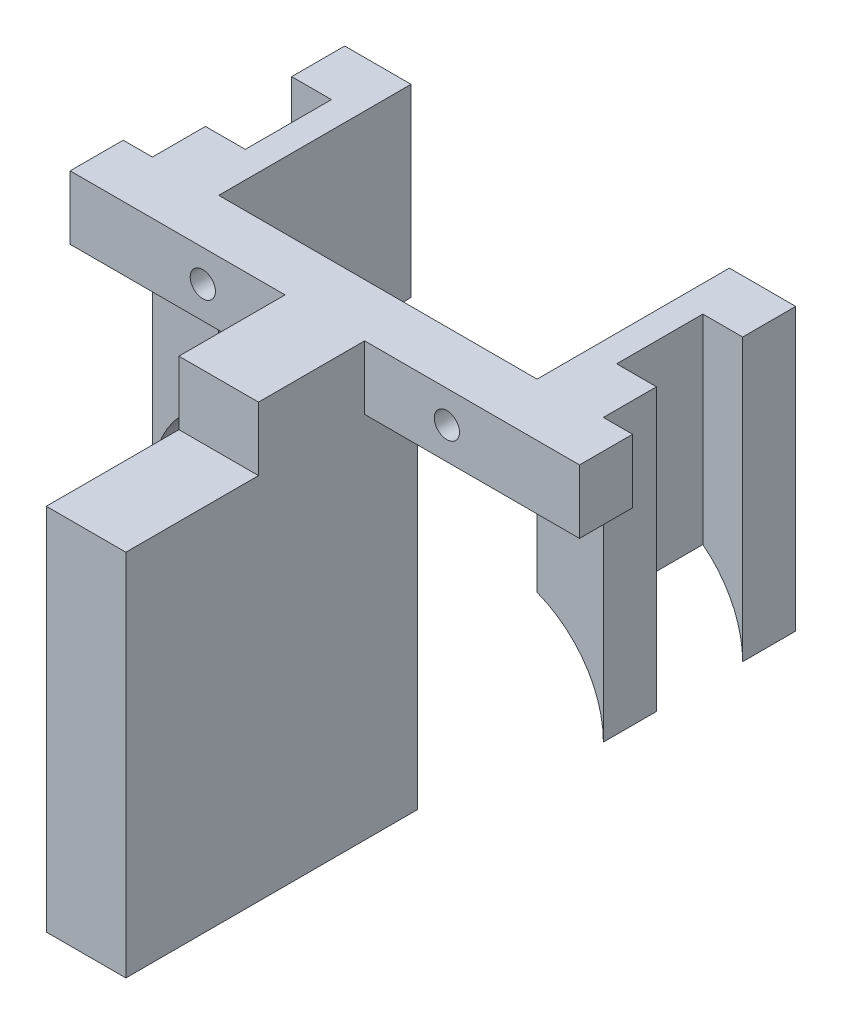
from build123d import *

# Parameters (mm, degrees)
SKETCH_1_W          = 38.4
SKETCH_1_H          = 4.8
SKETCH_1_R          = 0.95
EXTRUDE_1_DEPTH     = 4
EXTRUDE_2_DEPTH     = 21.2
SKETCH_5_R          = 7.8
CUT_EXTRUDE_2_DEPTH = 14.5
SKETCH_8_W          = 6
SKETCH_8_H          = 4.8
EXTRUDE_4_DEPTH     = 8
SKETCH_9_W          = 6
SKETCH_9_H          = 22
EXTRUDE_5_DEPTH     = 27.8


with BuildPart() as part:
    # 草图1 → 凸台-拉伸1 (new body)
    with BuildSketch(Plane.XY):
        with Locations((19.2, -2.4)):
            Rectangle(SKETCH_1_W, SKETCH_1_H)
        with Locations((10, -2.4)):
            Circle(SKETCH_1_R, mode=Mode.SUBTRACT)
        with Locations((28.4, -2.4)):
            Circle(SKETCH_1_R, mode=Mode.SUBTRACT)
    extrude(amount=EXTRUDE_1_DEPTH)

    # 草图4 → 凸台-拉伸2 (add)
    with BuildSketch(Plane(origin=(0, 0, 0), x_dir=(1, 0, 0), z_dir=(0, 1, 0))):
        Polygon((2.2, 0), (2.2, 4), (5.2, 4), (5.2, 10.5), (2.2, 10.5), (2.2, 14.5), (7.2, 14.5), (7.2, 0), align=None)
        Polygon((36.2, 0), (31.2, 0), (31.2, 14.5), (36.2, 14.5), (36.2, 10.5), (33.2, 10.5), (33.2, 4), (36.2, 4), align=None)
    extrude(amount=-EXTRUDE_2_DEPTH)

    # 草图5 → 切除-拉伸2 (cut)
    with BuildSketch(Plane(origin=(0, 0, -14.5), x_dir=(-1, 0, 0), z_dir=(0, 0, -1))):
        with Locations((-10, -21.2)):
            Circle(SKETCH_5_R)
        with Locations((-28.4, -21.2)):
            Circle(SKETCH_5_R)
    extrude(amount=-CUT_EXTRUDE_2_DEPTH, mode=Mode.SUBTRACT)

    # 草图8 → 凸台-拉伸4 (add)
    with BuildSketch(Plane.XY.offset(4)):
        with Locations((19.2, -2.4)):
            Rectangle(SKETCH_8_W, SKETCH_8_H)
    extrude(amount=EXTRUDE_4_DEPTH)

    # 草图9 → 凸台-拉伸5 (add)
    with BuildSketch(Plane.XZ.offset(4.8)):
        with Locations((19.2, 11)):
            Rectangle(SKETCH_9_W, SKETCH_9_H)
    extrude(amount=EXTRUDE_5_DEPTH)


solid = part.part
